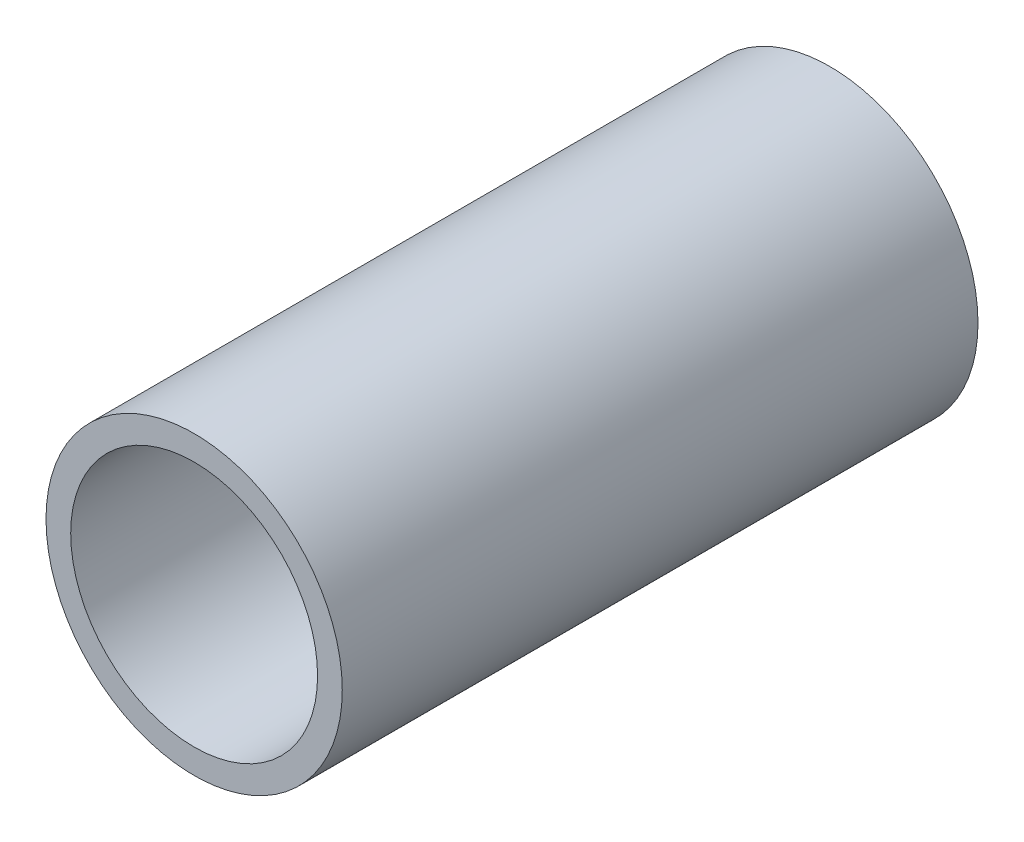
from build123d import *

# Parameters (mm, degrees)
SKETCH_1_R      = 6
SKETCH_1_R_2    = 5
EXTRUDE_1_DEPTH = 25.75


with BuildPart() as part:
    # 草图1 → 凸台-拉伸1 (new body)
    with BuildSketch(Plane.XY):
        Circle(SKETCH_1_R)
        Circle(SKETCH_1_R_2, mode=Mode.SUBTRACT)
    extrude(amount=EXTRUDE_1_DEPTH)


solid = part.part
